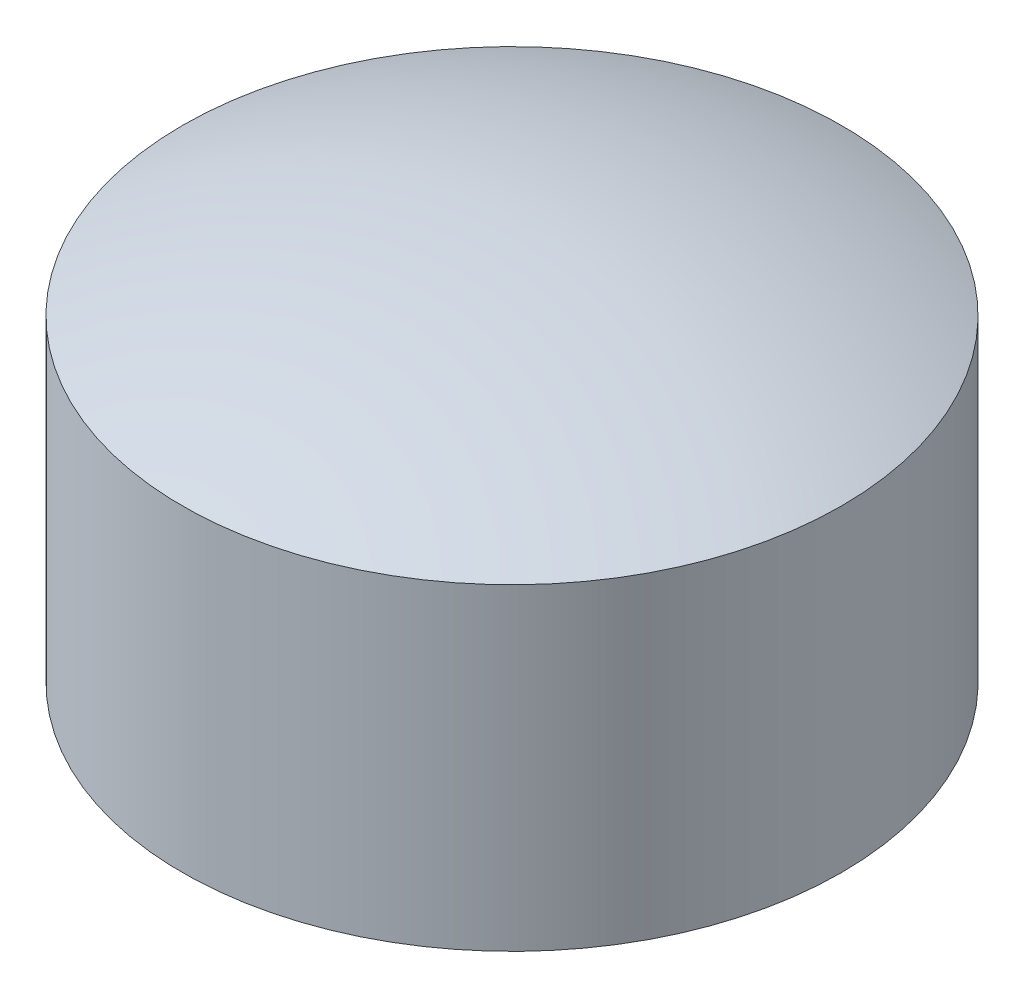
from build123d import *


with BuildPart() as part:
    # 草圖1 → 旋轉1 (revolve)
    with BuildSketch(Plane.XY):
        with BuildLine():
            Line((0, 0.5), (0, 1))
            ThreePointArc((0, 1), (-0.434530519, 0.954244016), (-0.85, 0.818983187))
            Line((-0.85, 0.818983187), (-0.85, 0))
            Line((-0.85, 0), (-0.5, 0))
            Line((-0.5, 0), (-0.5, 0.5))
            Line((-0.5, 0.5), (0, 0.5))
        make_face()
    revolve(axis=Axis((0, 1.755147141, 0), (0, -1, 0)))


solid = part.part
